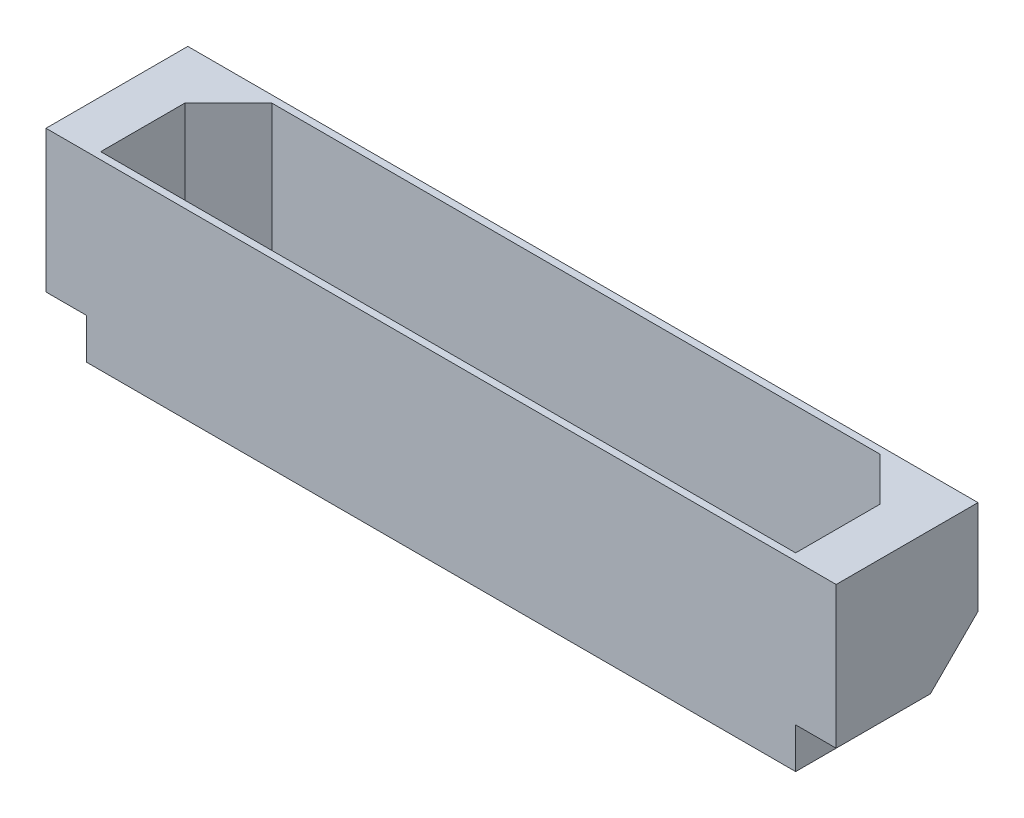
from build123d import *

# Parameters (mm, degrees)
SKETCH_1_W          = 390
SKETCH_1_H          = 70
EXTRUDE_1_DEPTH     = 90
SKETCH_2_W          = 20
SKETCH_2_H          = 20
CUT_EXTRUDE_1_DEPTH = 85
CUT_EXTRUDE_2_DEPTH = 20
CUT_EXTRUDE_3_DEPTH = 20
CUT_EXTRUDE_4_DEPTH = 86.5


with BuildPart() as part:
    # 草圖1 → 填料-伸長1 (new body)
    with BuildSketch(Plane(origin=(0, 0, 0), x_dir=(1, 0, 0), z_dir=(0, 1, 0))):
        Rectangle(SKETCH_1_W, SKETCH_1_H)
    extrude(amount=EXTRUDE_1_DEPTH)

    # 草圖2 → 除料-伸長1 (cut)
    with BuildSketch(Plane.XY.offset(35)):
        with Locations((185, 10)):
            Rectangle(SKETCH_2_W, SKETCH_2_H)
        with Locations((-185, 10)):
            Rectangle(SKETCH_2_W, SKETCH_2_H)
    extrude(amount=-CUT_EXTRUDE_1_DEPTH, mode=Mode.SUBTRACT)

    # 草圖3 → 除料-伸長2 (cut)
    with BuildSketch(Plane(origin=(195, 0, 0), x_dir=(0, 0, -1), z_dir=(1, 0, 0))):
        Polygon((35, 20), (11.5, 20), (35, 43.5), align=None)
    cut_extrude_2 = extrude(amount=-CUT_EXTRUDE_2_DEPTH, mode=Mode.SUBTRACT)

    # 鏡射1: 除料-伸長2 across plane
    add(cut_extrude_2.mirror(Plane(origin=(0, 0, 0), x_dir=(0, 0, 1), z_dir=(1, 0, 0))), mode=Mode.SUBTRACT)

    # 草圖4 → 除料-伸長3 (cut)
    with BuildSketch(Plane.XZ):
        Polygon((-151.5, -35), (-175, -35), (-175, -11.5), align=None)
        Polygon((175, -11.5), (151.5, -35), (175, -35), align=None)
    extrude(amount=-CUT_EXTRUDE_3_DEPTH, mode=Mode.SUBTRACT)

    # 草圖5 → 除料-伸長4 (cut)
    with BuildSketch(Plane(origin=(0, 90, 0), x_dir=(1, 0, 0), z_dir=(0, 1, 0))):
        Polygon((-171.5, 10.050252532), (-171.5, -31.5), (171.5, -31.5), (171.5, 10.050252532), (150.050252532, 31.5), (-150.050252532, 31.5), align=None)
    extrude(amount=-CUT_EXTRUDE_4_DEPTH, mode=Mode.SUBTRACT)


solid = part.part
